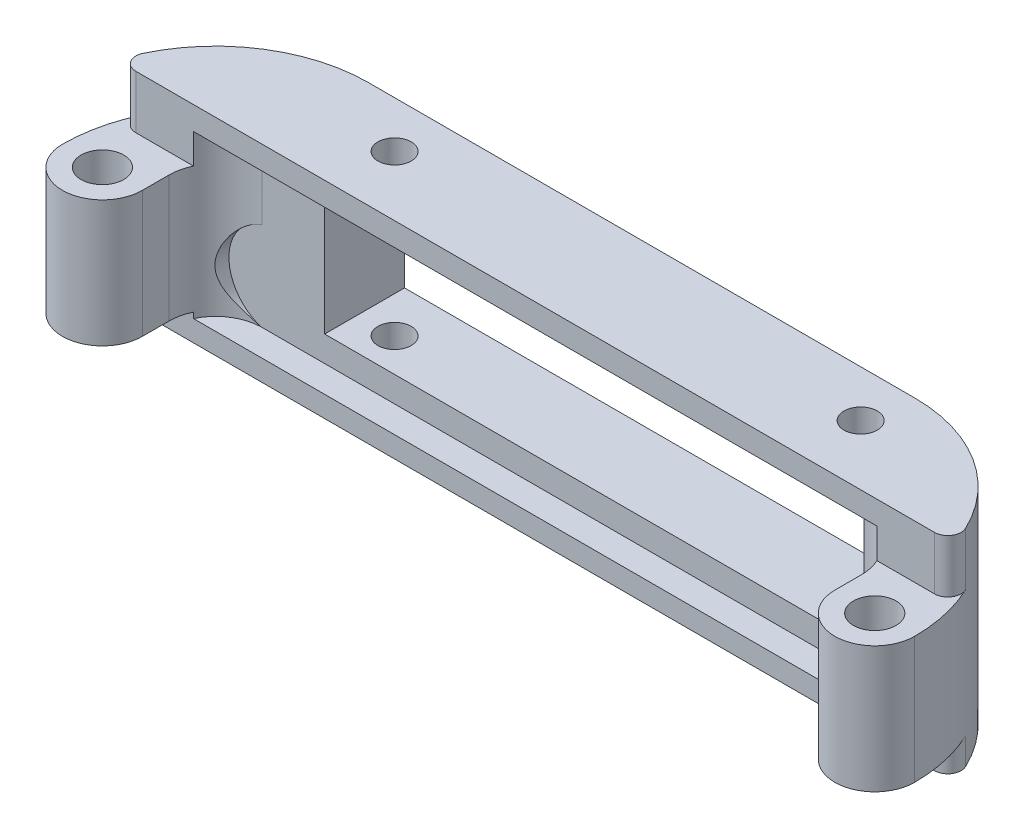
from build123d import *

# Parameters (mm, degrees)
ESQUISSE1_R             = 1.6
BOSS_EXTRU_1_DEPTH      = 15.5
ESQUISSE2_W             = 88.683684882
ESQUISSE2_H             = 17.311737923
ENL_V_MAT_EXTRU_1_DEPTH = 4
ENL_V_START             = -15.5
ESQUISSE2_2_W           = 88.683684882
ESQUISSE2_2_H           = 17.311737923
ENL_V_MAT_EXTRU_2_DEPTH = 2
ESQUISSE3_W             = 40.5
ESQUISSE3_H             = 10.25
ENL_V_MAT_EXTRU_3_DEPTH = 39.399218742
ESQUISSE4_R             = 1.25
ENL_V_MAT_EXTRU_4_DEPTH = 38.369773882
ESQUISSE5_R             = 3.5
ENL_V_MAT_EXTRU_5_DEPTH = 37.558172821
BOSS_EXTRU_2_START      = -1.75
BOSS_EXTRU_2_DEPTH      = 1.75
BOSS_EXTRU_3_START      = -15.5
BOSS_EXTRU_3_DEPTH      = 1.58
CONG_1_R                = 1


with BuildPart() as part:
    # Esquisse1 → Boss.-Extru.1 (new body)
    with BuildSketch(Plane(origin=(0, 0, 0), x_dir=(1, 0, 0), z_dir=(0, 1, 0))):
        with BuildLine():
            Line((-22.5, 5.5), (22.5, 5.5))
            ThreePointArc((22.5, 5.5), (24.974873734, 4.474873734), (26, 2))
            Line((26, 2), (26, 0))
            ThreePointArc((26, 0), (29, -3), (32, 0))
            ThreePointArc((32, 0), (28.631727984, 8.131727984), (20.5, 11.5))
            Line((20.5, 11.5), (-20.5, 11.5))
            ThreePointArc((-20.5, 11.5), (-28.631727984, 8.131727984), (-32, 0))
            ThreePointArc((-32, 0), (-29, -3), (-26, 0))
            Line((-26, 0), (-26, 2))
            ThreePointArc((-26, 2), (-24.974873734, 4.474873734), (-22.5, 5.5))
        make_face()
        with Locations(Location((-29, 0, 0), (0, 0, 270))):
            Circle(ESQUISSE1_R, mode=Mode.SUBTRACT)
        with Locations(Location((29, 0, 0), (0, 0, 270))):
            Circle(ESQUISSE1_R, mode=Mode.SUBTRACT)
    extrude(amount=BOSS_EXTRU_1_DEPTH)

    # Esquisse2 → Enlèv. mat.-Extru.1 (cut)
    with BuildSketch(Plane(origin=(0, 15.5, 0), x_dir=(1, 0, 0), z_dir=(0, 1, 0))):
        with Locations((-5.127432495, -5.155868962)):
            Rectangle(ESQUISSE2_W, ESQUISSE2_H)
    extrude(amount=-ENL_V_MAT_EXTRU_1_DEPTH, mode=Mode.SUBTRACT)

    # Esquisse2<2> → Enlèv. mat.-Extru.2 (cut)
    with BuildSketch(Plane(origin=(0, 15.5, 0), x_dir=(1, 0, 0), z_dir=(0, 1, 0)).offset(ENL_V_START)):
        with Locations((-5.127432495, -5.155868962)):
            Rectangle(ESQUISSE2_2_W, ESQUISSE2_2_H)
    extrude(amount=ENL_V_MAT_EXTRU_2_DEPTH, mode=Mode.SUBTRACT)

    # Esquisse3 → Enlèv. mat.-Extru.3 (cut, through all)
    with BuildSketch(Plane(origin=(0, 0, -11.5), x_dir=(-1, 0, 0), z_dir=(0, 0, -1))):
        with Locations((-2.440596151, 8.625)):
            Rectangle(ESQUISSE3_W, ESQUISSE3_H)
    extrude(amount=-ENL_V_MAT_EXTRU_3_DEPTH, mode=Mode.SUBTRACT)

    # Esquisse4 → Enlèv. mat.-Extru.4 (cut, through all)
    with BuildSketch(Plane(origin=(0, 15.5, 0), x_dir=(1, 0, 0), z_dir=(0, 1, 0))):
        with Locations(Location((19.940596151, 8, 0), (0, 0, 270))):
            Circle(ESQUISSE4_R)
        with Locations(Location((-15.059403849, 8, 0), (0, 0, 270))):
            Circle(ESQUISSE4_R)
    extrude(amount=-ENL_V_MAT_EXTRU_4_DEPTH, mode=Mode.SUBTRACT)

    # Esquisse5 → Enlèv. mat.-Extru.5 (cut, through all)
    with BuildSketch(Plane.XY.offset(-5.5)):
        with Locations((-21.5, 4.9)):
            Circle(ESQUISSE5_R)
        with BuildLine():
            Line((13.351466812, 5.58), (24, 5.58))
            ThreePointArc((24, 5.58), (26, 3.58), (24, 1.58))
            Line((24, 1.58), (13.351466812, 1.58))
            ThreePointArc((13.351466812, 1.58), (11.351466812, 3.58), (13.351466812, 5.58))
        make_face()
    extrude(amount=ENL_V_MAT_EXTRU_5_DEPTH, mode=Mode.SUBTRACT)

    # Esquisse6 → Boss.-Extru.2 (add)
    with BuildSketch(Plane(origin=(0, 15.5, 0), x_dir=(1, 0, 0), z_dir=(0, 1, 0)).offset(BOSS_EXTRU_2_START)):
        with BuildLine():
            Line((-22.5, 5.5), (22.5, 5.5))
            ThreePointArc((22.5, 5.5), (24.370828693, 4.958039892), (25.66227766, 3.5))
            Line((25.66227766, 3.5), (-25.66227766, 3.5))
            ThreePointArc((-25.66227766, 3.5), (-24.370828693, 4.958039892), (-22.5, 5.5))
        make_face()
    extrude(amount=BOSS_EXTRU_2_DEPTH)

    # Esquisse6<2> → Boss.-Extru.3 (add)
    with BuildSketch(Plane(origin=(0, 15.5, 0), x_dir=(1, 0, 0), z_dir=(0, 1, 0)).offset(BOSS_EXTRU_3_START)):
        with BuildLine():
            Line((-22.5, 5.5), (22.5, 5.5))
            ThreePointArc((22.5, 5.5), (24.370828693, 4.958039892), (25.66227766, 3.5))
            Line((25.66227766, 3.5), (-25.66227766, 3.5))
            ThreePointArc((-25.66227766, 3.5), (-24.370828693, 4.958039892), (-22.5, 5.5))
        make_face()
    extrude(amount=BOSS_EXTRU_3_DEPTH)

    # Congé1
    cong_1_edges = [part.edges().sort_by_distance(p)[0] for p in [
        (-31.45445115, 13.5, -3.5),
        (31.45445115, 13.5, -3.5),
        (-31.45445115, 1, -3.5),
        (31.45445115, 1, -3.5),
    ]]
    fillet(cong_1_edges, radius=CONG_1_R)


solid = part.part
